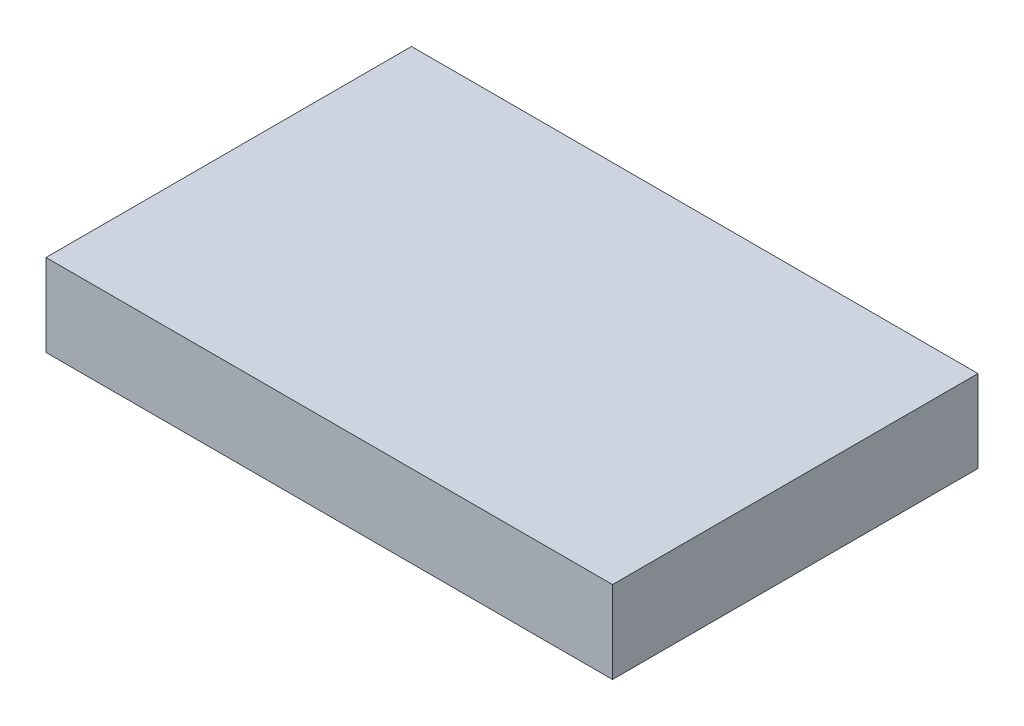
from build123d import *

# Parameters (mm, degrees)
SKETCH1_W           = 124
SKETCH1_H           = 80
BOSS_EXTRUDE1_DEPTH = 18


with BuildPart() as part:
    # Sketch1 → Boss-Extrude1 (new body)
    with BuildSketch(Plane(origin=(0, 0, 0), x_dir=(1, 0, 0), z_dir=(0, 1, 0))):
        Rectangle(SKETCH1_W, SKETCH1_H)
    extrude(amount=BOSS_EXTRUDE1_DEPTH)


solid = part.part
